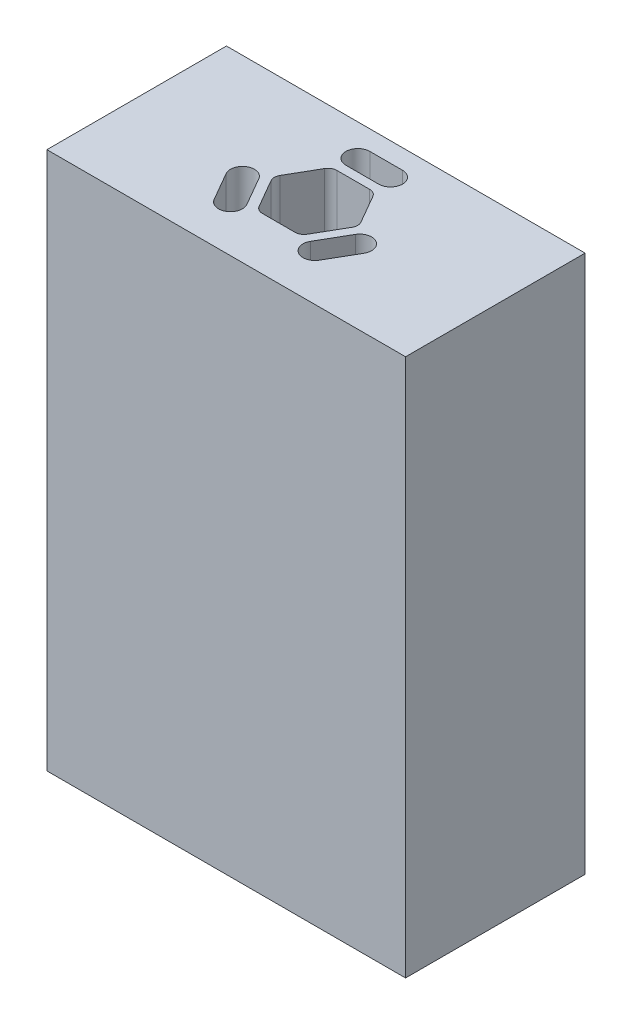
from build123d import *

# Parameters (mm, degrees)
SKETCH6_W           = 2
SKETCH6_H           = 1.001148594
BOSS_EXTRUDE7_DEPTH = 3
CUT_EXTRUDE3_DEPTH  = 0.9
SKETCH5_R           = 0.207846097
CUT_EXTRUDE4_DEPTH  = 2.7


with BuildPart() as part:
    # Sketch6 → Boss-Extrude7 (new body)
    with BuildSketch(Plane.XZ):
        Rectangle(SKETCH6_W, SKETCH6_H)
    extrude(amount=BOSS_EXTRUDE7_DEPTH)

    # Sketch1 → Cut-Extrude3 (cut)
    with BuildSketch(Plane(origin=(0, 0, 0), x_dir=(1, 0, 0), z_dir=(0, 1, 0))):
        with BuildLine():
            Line((-0.091132487, 0.257846097), (0.091132487, 0.257846097))
            ThreePointArc((0.091132487, 0.257846097), (0.157927132, 0.324640742), (0.091132487, 0.391435388))
            Line((0.091132487, 0.391435388), (-0.091132487, 0.391435388))
            ThreePointArc((-0.091132487, 0.391435388), (-0.157927132, 0.324640742), (-0.091132487, 0.257846097))
        make_face()
        with BuildLine():
            Line((-0.134433757, 0.182846097), (-0.225566243, 0.025))
            ThreePointArc((-0.225566243, 0.025), (-0.232264973, 0), (-0.225566243, -0.025))
            Line((-0.225566243, -0.025), (-0.134433757, -0.182846097))
            ThreePointArc((-0.134433757, -0.182846097), (-0.116132487, -0.201147367), (-0.091132487, -0.207846097))
            Line((-0.091132487, -0.207846097), (0.091132487, -0.207846097))
            ThreePointArc((0.091132487, -0.207846097), (0.116132487, -0.201147367), (0.134433757, -0.182846097))
            Line((0.134433757, -0.182846097), (0.225566243, -0.025))
            ThreePointArc((0.225566243, -0.025), (0.232264973, 0), (0.225566243, 0.025))
            Line((0.225566243, 0.025), (0.134433757, 0.182846097))
            ThreePointArc((0.134433757, 0.182846097), (0.116132487, 0.201147367), (0.091132487, 0.207846097))
            Line((0.091132487, 0.207846097), (-0.091132487, 0.207846097))
            ThreePointArc((-0.091132487, 0.207846097), (-0.116132487, 0.201147367), (-0.134433757, 0.182846097))
        make_face()
        with BuildLine():
            Line((0.293426746, -0.274640742), (0.384559233, -0.116794645))
            ThreePointArc((0.384559233, -0.116794645), (0.360110696, -0.025551463), (0.268867513, -0.05))
            Line((0.268867513, -0.05), (0.177735027, -0.207846097))
            ThreePointArc((0.177735027, -0.207846097), (0.202183564, -0.299089279), (0.293426746, -0.274640742))
        make_face()
        with BuildLine():
            Line((-0.384559233, -0.116794645), (-0.293426746, -0.274640742))
            ThreePointArc((-0.293426746, -0.274640742), (-0.202183564, -0.299089279), (-0.177735027, -0.207846097))
            Line((-0.177735027, -0.207846097), (-0.268867513, -0.05))
            ThreePointArc((-0.268867513, -0.05), (-0.360110696, -0.025551463), (-0.384559233, -0.116794645))
        make_face()
    extrude(amount=-CUT_EXTRUDE3_DEPTH, mode=Mode.SUBTRACT)

    # Sketch5 → Cut-Extrude4 (cut)
    with BuildSketch(Plane(origin=(0, 0.6, 0), x_dir=(1, 0, 0), z_dir=(0, 1, 0))):
        with Locations(Location((0, 0, 0), (0, 0, 270))):
            Circle(SKETCH5_R)
    extrude(amount=-CUT_EXTRUDE4_DEPTH, mode=Mode.SUBTRACT)


solid = part.part
